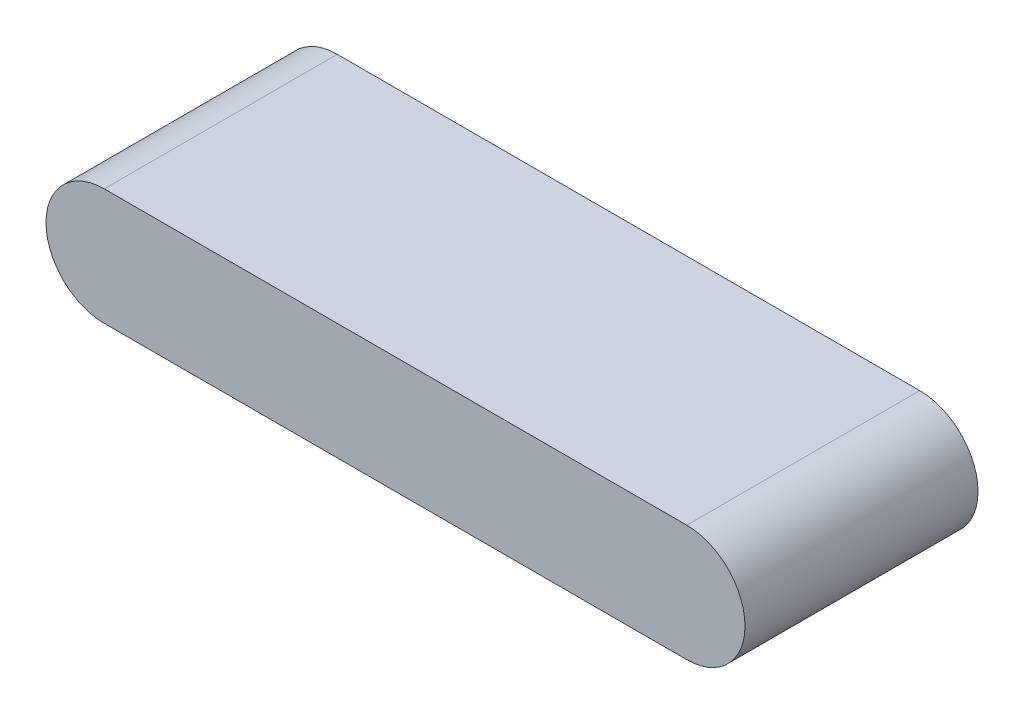
from build123d import *

# Parameters (mm, degrees)
BOSS_EXTRUDE1_DEPTH = 25.4


with BuildPart() as part:
    # Sketch1 → Boss-Extrude1 (new, symmetric)
    with BuildSketch(Plane.XY):
        with BuildLine():
            Line((-53.798308188, 12.7), (73.201691812, 12.7))
            ThreePointArc((73.201691812, 12.7), (85.901691812, 0), (73.201691812, -12.7))
            Line((73.201691812, -12.7), (-53.798308188, -12.7))
            ThreePointArc((-53.798308188, -12.7), (-66.498308188, 0), (-53.798308188, 12.7))
        make_face()
    extrude(amount=BOSS_EXTRUDE1_DEPTH, both=True)


solid = part.part
